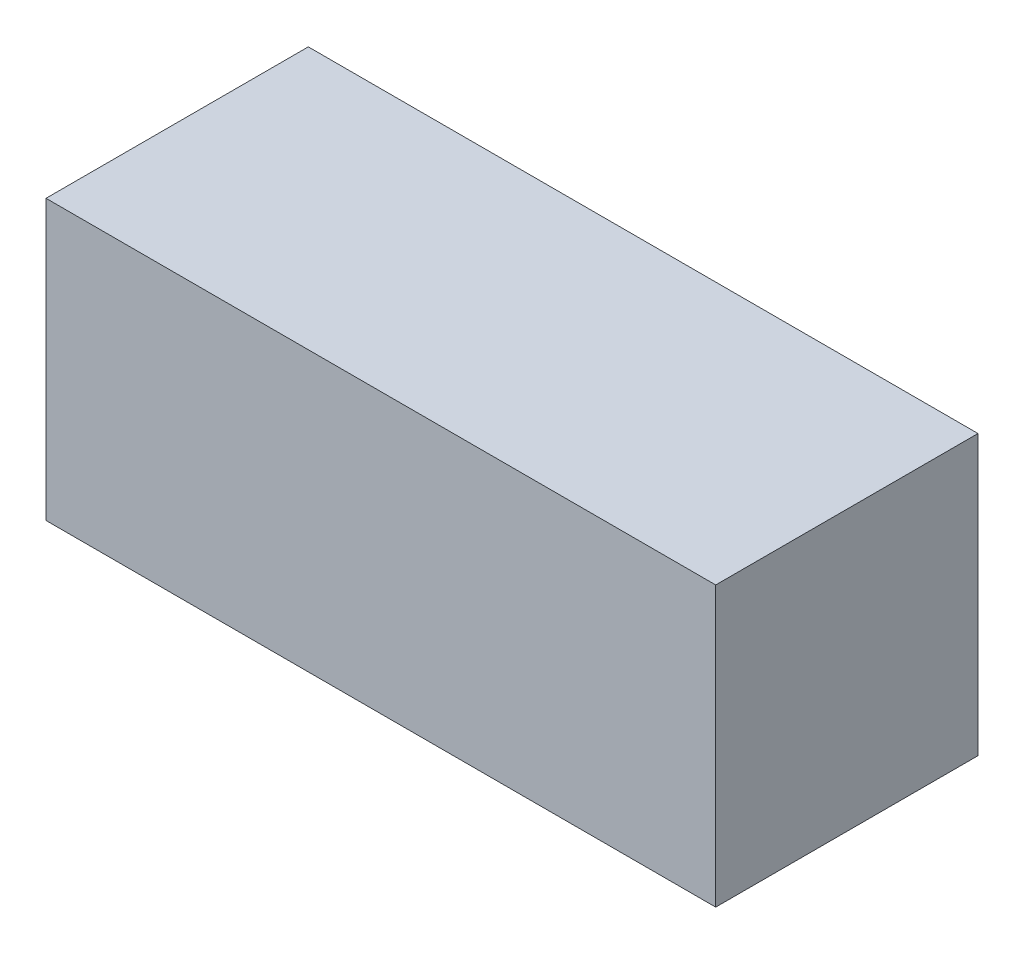
from build123d import *

# Parameters (mm, degrees)
SKETCH_1_W      = 120
SKETCH_1_H      = 47
EXTRUDE_1_DEPTH = 50


with BuildPart() as part:
    # 草图1 → 凸台-拉伸1 (new body)
    with BuildSketch(Plane(origin=(0, 0, 0), x_dir=(1, 0, 0), z_dir=(0, 1, 0))):
        with Locations((60, 23.5)):
            Rectangle(SKETCH_1_W, SKETCH_1_H)
    extrude(amount=EXTRUDE_1_DEPTH)


solid = part.part
